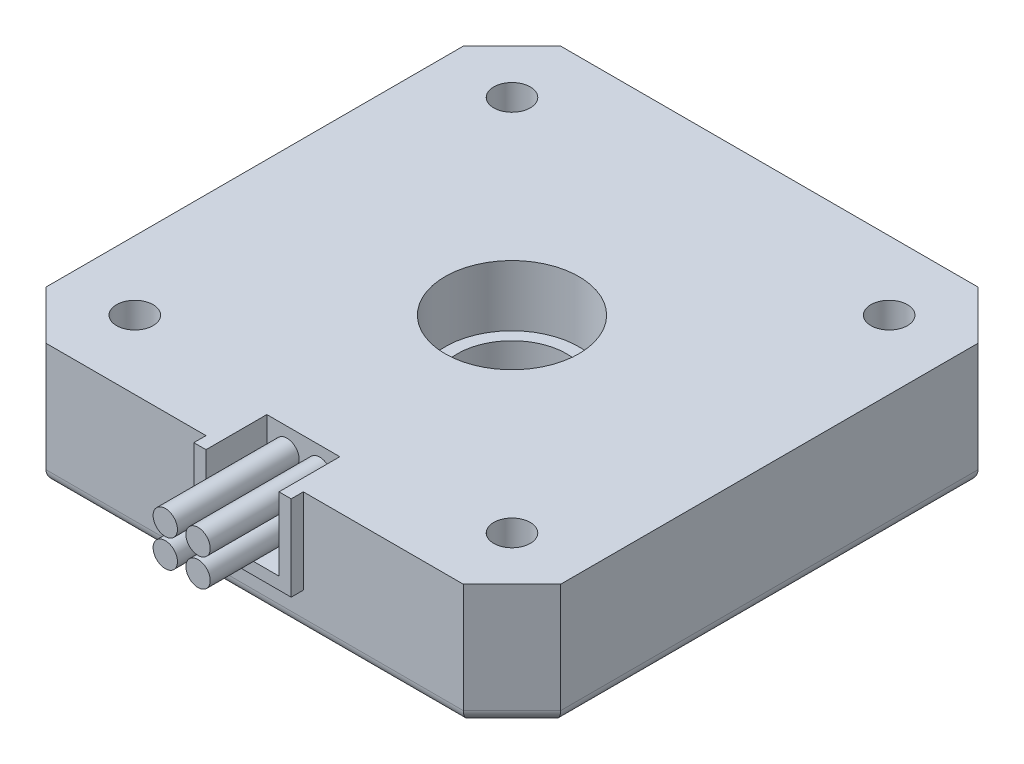
from build123d import *

# Parameters (mm, degrees)
BOSS_EXTRUDE1_DEPTH = 10
SKETCH2_R           = 1.5
CUT_EXTRUDE1_DEPTH  = 10
SKETCH3_R           = 3.1
CUT_EXTRUDE2_DEPTH  = 3
FILLET1_R           = 0.5
SKETCH4_R           = 4.5
CUT_EXTRUDE3_DEPTH  = 10
FILLET2_R           = 0.5
SKETCH5_R           = 5.5
CUT_EXTRUDE4_DEPTH  = 5
FILLET3_R           = 1
SKETCH6_W           = 8
SKETCH6_H           = 7
BOSS_EXTRUDE2_DEPTH = 1
SKETCH7_W           = 6
SKETCH7_H           = 6
CUT_EXTRUDE5_DEPTH  = 5
SKETCH8_R           = 1
BOSS_EXTRUDE4_DEPTH = 10


with BuildPart() as part:
    # Sketch1 → Boss-Extrude1 (new body)
    with BuildSketch(Plane(origin=(0, 0, 0), x_dir=(1, 0, 0), z_dir=(0, 1, 0))):
        Polygon((-21.15, 17.15), (-17.15, 21.15), (17.15, 21.15), (21.15, 17.15), (21.15, -17.15), (17.15, -21.15), (-17.15, -21.15), (-21.15, -17.15), align=None)
    extrude(amount=BOSS_EXTRUDE1_DEPTH)

    # Sketch2 → Cut-Extrude1 (cut)
    with BuildSketch(Plane.XZ):
        with Locations(Location((-15.5, 15.5, 0), (0, 0, 270))):
            Circle(SKETCH2_R)
        with Locations(Location((15.5, 15.5, 0), (0, 0, 90))):
            Circle(SKETCH2_R)
        with Locations(Location((15.5, -15.5, 0), (0, 0, 270))):
            Circle(SKETCH2_R)
        with Locations(Location((-15.5, -15.5, 0), (0, 0, 90))):
            Circle(SKETCH2_R)
    extrude(amount=-CUT_EXTRUDE1_DEPTH, mode=Mode.SUBTRACT)

    # Sketch3 → Cut-Extrude2 (cut)
    with BuildSketch(Plane.XZ):
        with Locations(Location((-15.5, 15.5, 0), (0, 0, 270))):
            Circle(SKETCH3_R)
        with Locations(Location((15.5, 15.5, 0), (0, 0, 90))):
            Circle(SKETCH3_R)
        with Locations(Location((15.5, -15.5, 0), (0, 0, 270))):
            Circle(SKETCH3_R)
        with Locations(Location((-15.5, -15.5, 0), (0, 0, 90))):
            Circle(SKETCH3_R)
    extrude(amount=-CUT_EXTRUDE2_DEPTH, mode=Mode.SUBTRACT)

    # Fillet1
    fillet1_edges = [part.edges().sort_by_distance(p)[0] for p in [
        (-15.5, 0, -18.6),
        (-15.5, 3, -18.6),
        (15.5, 0, -12.4),
        (15.5, 3, -12.4),
        (15.5, 0, 12.4),
        (15.5, 3, 12.4),
        (-15.5, 0, 18.6),
        (-15.5, 3, 18.6),
    ]]
    fillet(fillet1_edges, radius=FILLET1_R)

    # Sketch4 → Cut-Extrude3 (cut)
    with BuildSketch(Plane.XZ):
        with Locations(Location((0, 0, 0), (0, 0, 270))):
            Circle(SKETCH4_R)
    extrude(amount=-CUT_EXTRUDE3_DEPTH, mode=Mode.SUBTRACT)

    # Fillet2
    fillet2_edges = [part.edges().sort_by_distance(p)[0] for p in [
        (0, 0, 4.5),
    ]]
    fillet(fillet2_edges, radius=FILLET2_R)

    # Sketch5 → Cut-Extrude4 (cut)
    with BuildSketch(Plane(origin=(0, 10, 0), x_dir=(1, 0, 0), z_dir=(0, 1, 0))):
        with Locations(Location((0, 0, 0), (0, 0, 270))):
            Circle(SKETCH5_R)
    extrude(amount=-CUT_EXTRUDE4_DEPTH, mode=Mode.SUBTRACT)

    # Fillet3
    fillet3_edges = [part.edges().sort_by_distance(p)[0] for p in [
        (-19.15, 0, -19.15),
        (0, 0, -21.15),
        (19.15, 0, -19.15),
        (21.15, 0, 0),
        (19.15, 0, 19.15),
        (0, 0, 21.15),
        (-19.15, 0, 19.15),
        (-21.15, 0, 0),
    ]]
    fillet(fillet3_edges, radius=FILLET3_R)

    # Sketch6 → Boss-Extrude2 (add)
    with BuildSketch(Plane.XY.offset(21.15)):
        with Locations((0, 6.5)):
            Rectangle(SKETCH6_W, SKETCH6_H)
    extrude(amount=BOSS_EXTRUDE2_DEPTH)

    # Sketch7 → Cut-Extrude5 (cut)
    with BuildSketch(Plane.XY.offset(22.15)):
        with Locations((0, 7)):
            Rectangle(SKETCH7_W, SKETCH7_H)
    extrude(amount=-CUT_EXTRUDE5_DEPTH, mode=Mode.SUBTRACT)

    # Sketch8 → Boss-Extrude4 (add)
    with BuildSketch(Plane.XY.offset(17.15)):
        with Locations((-1.347255874, 5.854684621)):
            Circle(SKETCH8_R)
        with Locations(Location((1.347255874, 5.854684621, 0), (0, 0, 180))):
            Circle(SKETCH8_R)
        with Locations((1.347255874, 8.145315379)):
            Circle(SKETCH8_R)
        with Locations(Location((-1.347255874, 8.145315379, 0), (0, 0, 180))):
            Circle(SKETCH8_R)
    extrude(amount=BOSS_EXTRUDE4_DEPTH)


solid = part.part
